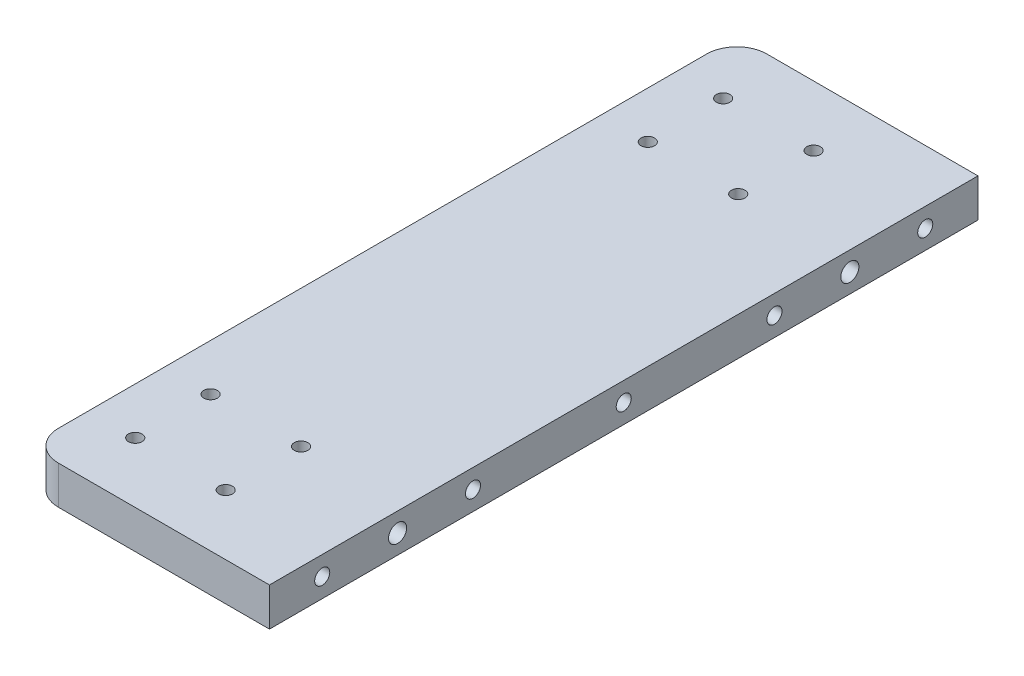
from build123d import *

# Parameters (mm, degrees)
SKETCH1_R                       = 2.25
BOSS_EXTRUDE1_DEPTH             = 12.7
TAP_DRILL_FOR_M6X1_0_TAP1_D     = 5
TAP_DRILL_FOR_M6X1_0_TAP1_DEPTH = 17
TAP_DRILL_FOR_M6X1_0_TAP1_TIP   = 1.502151548
F_6_0MM_DOWEL_HOLE1_D           = 6
F_6_0MM_DOWEL_HOLE1_DEPTH       = 17
F_6_0MM_DOWEL_HOLE1_TIP         = 1.802581857


with BuildPart() as part:
    # Sketch1 → Boss-Extrude1 (new body)
    with BuildSketch(Plane(origin=(0, 0, 0), x_dir=(1, 0, 0), z_dir=(0, 1, 0))):
        with BuildLine():
            Line((48.34884719, 117.5), (48.34884719, -117.5))
            Line((48.34884719, -117.5), (-21.65115281, -117.5))
            ThreePointArc((-21.65115281, -117.5), (-28.722220622, -114.571067812), (-31.65115281, -107.5))
            Line((-31.65115281, -107.5), (-31.65115281, 107.5))
            ThreePointArc((-31.65115281, 107.5), (-28.722220622, 114.571067812), (-21.65115281, 117.5))
            Line((-21.65115281, 117.5), (48.34884719, 117.5))
        make_face()
        with Locations(Location((-16.17615281, -97.5, 0), (0, 0, 270))):
            Circle(SKETCH1_R, mode=Mode.SUBTRACT)
        with Locations(Location((13.82384719, -97.5, 0), (0, 0, 270))):
            Circle(SKETCH1_R, mode=Mode.SUBTRACT)
        with Locations(Location((13.82384719, -72.5, 0), (0, 0, 270))):
            Circle(SKETCH1_R, mode=Mode.SUBTRACT)
        with Locations(Location((-16.17615281, -72.5, 0), (0, 0, 270))):
            Circle(SKETCH1_R, mode=Mode.SUBTRACT)
        with Locations(Location((-16.17615281, 72.5, 0), (0, 0, 270))):
            Circle(SKETCH1_R, mode=Mode.SUBTRACT)
        with Locations(Location((-16.17615281, 97.5, 0), (0, 0, 270))):
            Circle(SKETCH1_R, mode=Mode.SUBTRACT)
        with Locations(Location((13.82384719, 97.5, 0), (0, 0, 270))):
            Circle(SKETCH1_R, mode=Mode.SUBTRACT)
        with Locations(Location((13.82384719, 72.5, 0), (0, 0, 270))):
            Circle(SKETCH1_R, mode=Mode.SUBTRACT)
    extrude(amount=BOSS_EXTRUDE1_DEPTH)

    # Tap Drill for M6x1.0 Tap1
    with Locations(Plane(origin=(48.34884719, 0, 0), x_dir=(0, 0, -1), z_dir=(1, 0, 0))):
        with Locations((-100, 6.35), (-50, 6.35), (0, 6.35), (50, 6.35), (100, 6.35)):
            Hole(TAP_DRILL_FOR_M6X1_0_TAP1_D / 2, depth=TAP_DRILL_FOR_M6X1_0_TAP1_DEPTH)
            with Locations((0, 0, -(TAP_DRILL_FOR_M6X1_0_TAP1_DEPTH + TAP_DRILL_FOR_M6X1_0_TAP1_TIP / 2))):  # 118° drill point
                Cone(0, TAP_DRILL_FOR_M6X1_0_TAP1_D / 2, TAP_DRILL_FOR_M6X1_0_TAP1_TIP, mode=Mode.SUBTRACT)

    # Ø6.0mm Dowel Hole1
    with Locations(Plane(origin=(48.34884719, 0, 0), x_dir=(0, 0, -1), z_dir=(1, 0, 0))):
        with Locations((-75, 6.35), (75, 6.35)):
            Hole(F_6_0MM_DOWEL_HOLE1_D / 2, depth=F_6_0MM_DOWEL_HOLE1_DEPTH)
            with Locations((0, 0, -(F_6_0MM_DOWEL_HOLE1_DEPTH + F_6_0MM_DOWEL_HOLE1_TIP / 2))):  # 118° drill point
                Cone(0, F_6_0MM_DOWEL_HOLE1_D / 2, F_6_0MM_DOWEL_HOLE1_TIP, mode=Mode.SUBTRACT)


solid = part.part
